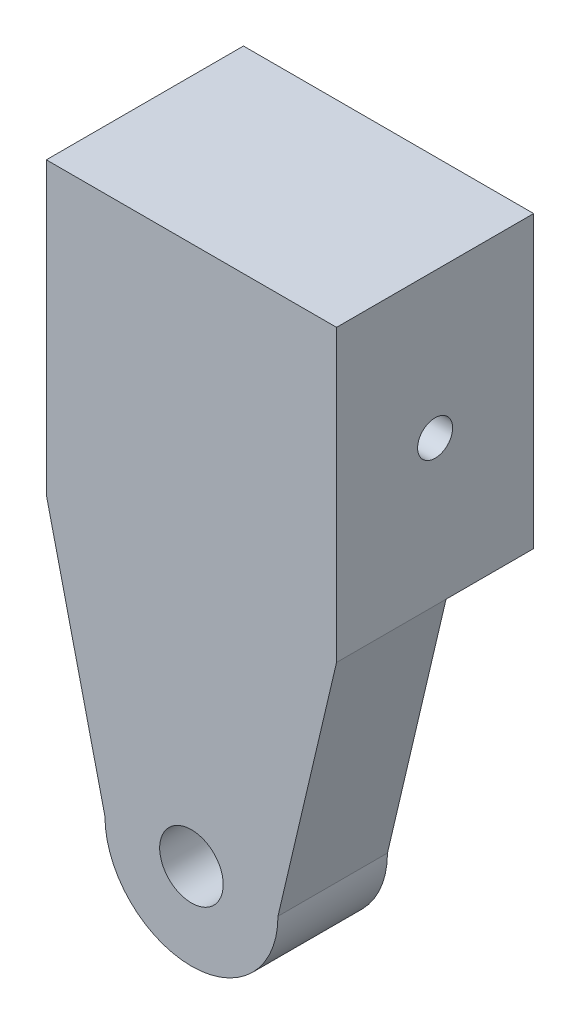
from build123d import *

# Parameters (mm, degrees)
CROQUIS1_W                   = 26.5
CROQUIS1_H                   = 26.5
CROQUIS1_W_2                 = 20.5
CROQUIS1_H_2                 = 20.5
SALIENTE_EXTRUIR1_DEPTH      = 9
SALIENTE_EXTRUIR2_DEPTH      = 9
SALIENTE_EXTRUIR2_DEPTH_BACK = 1
CROQUIS2_R                   = 2.9
CROQUIS5_W                   = 20.5
CROQUIS5_H                   = 20.5
SALIENTE_EXTRUIR3_DEPTH      = 1
NERVIO6_REACH                = 48.731
CROQUIS3_WALL_W              = 111.809486112
CROQUIS3_WALL_H              = 10
CROQUIS4_R                   = 1.6
CORTAR_EXTRUIR2_DEPTH        = 25


with BuildPart() as part:
    # Croquis1 → Saliente-Extruir1 (new, symmetric)
    with BuildSketch(Plane.XY):
        Rectangle(CROQUIS1_W, CROQUIS1_H)
        Rectangle(CROQUIS1_W_2, CROQUIS1_H_2, mode=Mode.SUBTRACT)
    extrude(amount=SALIENTE_EXTRUIR1_DEPTH, both=True)

    # Croquis2 → Saliente-Extruir2 (add, two sides: drawn at the far end of the back side and taken through both)
    with BuildSketch(Plane.XY.offset(-SALIENTE_EXTRUIR2_DEPTH_BACK)):
        with BuildLine():
            Line((-7.9, -36), (-13.25, -13.25))
            Line((-13.25, -13.25), (13.25, -13.25))
            Line((13.25, -13.25), (7.9, -36))
            ThreePointArc((7.9, -36), (0, -43.9), (-7.9, -36))
        make_face()
        with Locations((0, -36)):
            Circle(CROQUIS2_R, mode=Mode.SUBTRACT)
    extrude(amount=SALIENTE_EXTRUIR2_DEPTH + SALIENTE_EXTRUIR2_DEPTH_BACK)

    # Croquis5 → Saliente-Extruir3 (add)
    with BuildSketch(Plane.XY.offset(9)):
        Rectangle(CROQUIS5_W, CROQUIS5_H)
    extrude(amount=-SALIENTE_EXTRUIR3_DEPTH)

    # Croquis3 wall → Nervio6 (add, up to next)
    with BuildSketch(Plane(origin=(0, -20.75, -4.25), x_dir=(0, 0.91755562531, -0.397607437634), z_dir=(0, 0.397607437634, 0.91755562531)), mode=Mode.PRIVATE) as nervio6_sk1:
        Rectangle(CROQUIS3_WALL_W, CROQUIS3_WALL_H)
    nervio6_tool1 = extrude(nervio6_sk1.sketch, amount=NERVIO6_REACH, mode=Mode.PRIVATE) - part.part
    add(nervio6_tool1.solids().sort_by_distance((0, -20.75, -4.25))[0])

    # Croquis4 → Cortar-Extruir2 (cut, symmetric)
    with BuildSketch(Plane(origin=(0, 0, 0), x_dir=(0, 0, -1), z_dir=(1, 0, 0))):
        Circle(CROQUIS4_R)
    extrude(amount=CORTAR_EXTRUIR2_DEPTH, both=True, mode=Mode.SUBTRACT)


solid = part.part
